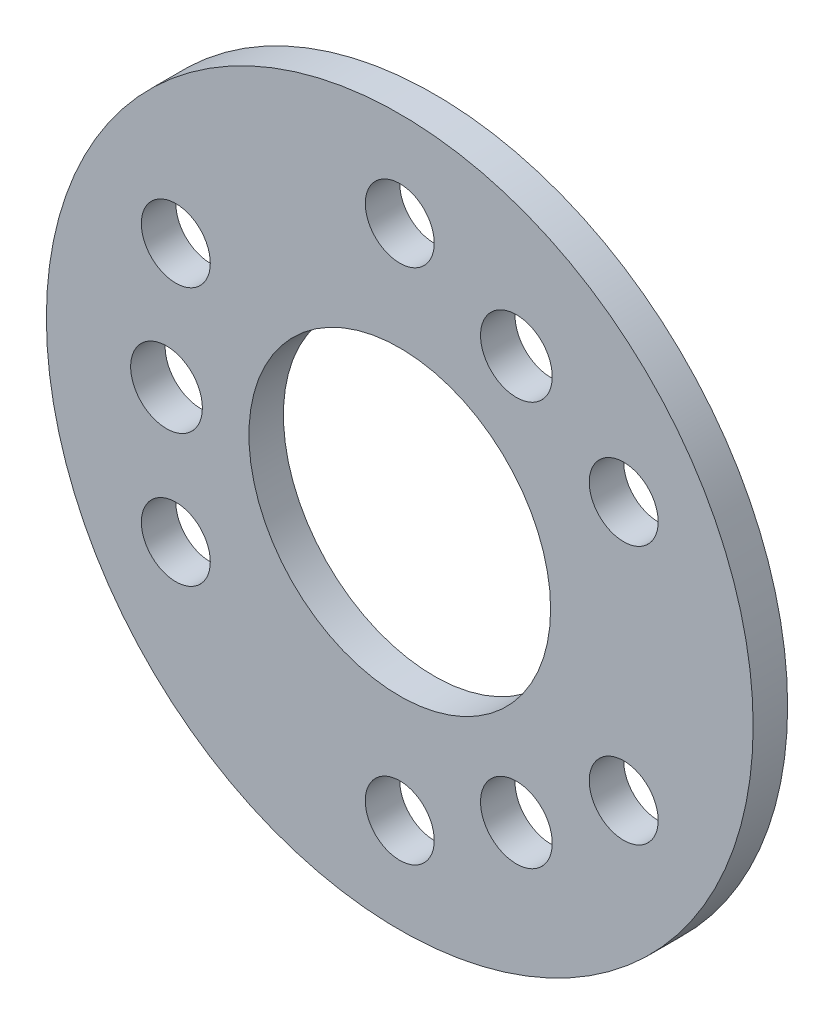
from build123d import *

# Parameters (mm, degrees)
SKETCH_1_R      = 20.5
SKETCH_1_R_2    = 2
SKETCH_1_R_3    = 2.08
SKETCH_1_R_4    = 8.75
EXTRUDE_1_DEPTH = 2


with BuildPart() as part:
    # 草图1 → 凸台-拉伸1 (new body)
    with BuildSketch(Plane.XY):
        with Locations((-0.985220571, 0.129022057)):
            Circle(SKETCH_1_R)
        with Locations((-0.985220571, -14.870977943)):
            Circle(SKETCH_1_R_2, mode=Mode.SUBTRACT)
        with Locations((-13.975601628, -7.370977943)):
            Circle(SKETCH_1_R_2, mode=Mode.SUBTRACT)
        with Locations((-13.975601628, 7.629022057)):
            Circle(SKETCH_1_R_2, mode=Mode.SUBTRACT)
        with Locations((-0.985220571, 15.129022057)):
            Circle(SKETCH_1_R_2, mode=Mode.SUBTRACT)
        with Locations((12.005160486, 7.629022057)):
            Circle(SKETCH_1_R_2, mode=Mode.SUBTRACT)
        with Locations((12.005160486, -7.370977943)):
            Circle(SKETCH_1_R_2, mode=Mode.SUBTRACT)
        with Locations((-14.515220571, 0.129022057)):
            Circle(SKETCH_1_R_3, mode=Mode.SUBTRACT)
        with Locations((5.779779429, 11.84634577)):
            Circle(SKETCH_1_R_3, mode=Mode.SUBTRACT)
        with Locations((5.779779429, -11.588301656)):
            Circle(SKETCH_1_R_3, mode=Mode.SUBTRACT)
        with Locations((-0.985220571, 0.129022057)):
            Circle(SKETCH_1_R_4, mode=Mode.SUBTRACT)
    extrude(amount=EXTRUDE_1_DEPTH)


solid = part.part
